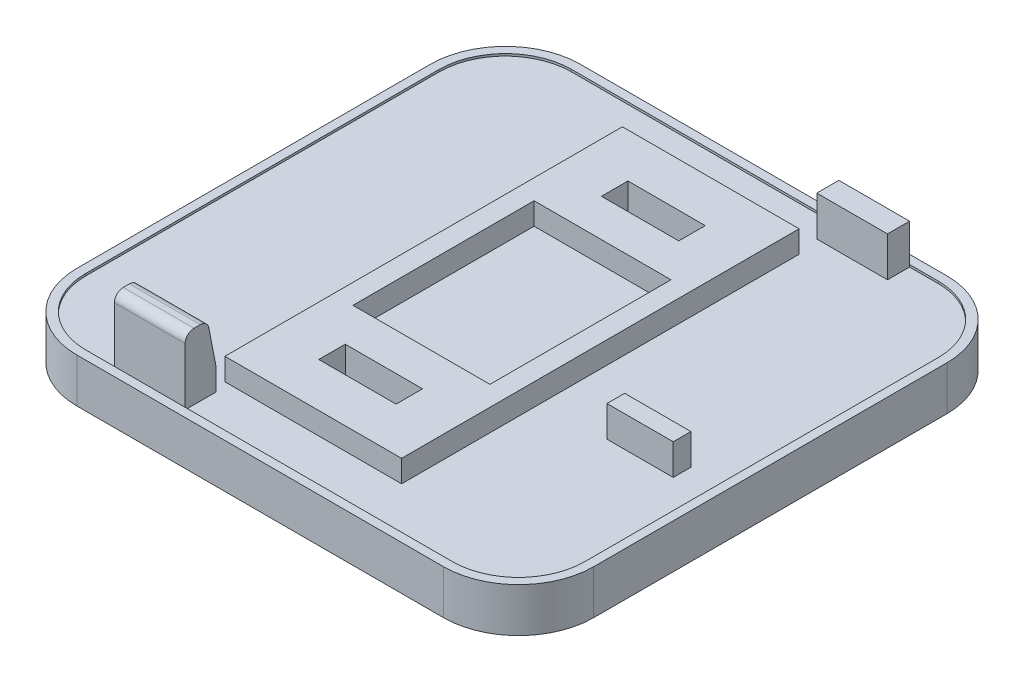
from build123d import *

# Parameters (mm, degrees)
RESSALTO_EXTRUS_O1_DEPTH = 2
CORTE_EXTRUS_O1_DEPTH    = 0.1
ESBO_O3_W                = 8
ESBO_O3_H                = 18
ESBO_O3_W_2              = 6.2
ESBO_O3_H_2              = 8.2
RESSALTO_EXTRUS_O2_DEPTH = 1
ESBO_O4_W                = 3.2
ESBO_O4_H                = 1
RESSALTO_EXTRUS_O3_DEPTH = 1.8
ESBO_O5_W                = 3.2
ESBO_O5_H                = 1.4
RESSALTO_EXTRUS_O4_DEPTH = 3
CHANFRO1_SIZE            = 2
CHANFRO1_SIZE2           = 0.388760618
FILETE1_R                = 0.4
ESBO_O6_W                = 3
ESBO_O6_H                = 0.8
RESSALTO_EXTRUS_O5_DEPTH = 1.4
ESBO_O7_W                = 3.5
ESBO_O7_H                = 1.2
CORTE_EXTRUS_O2_DEPTH    = 5


with BuildPart() as part:
    # Esboço1 → Ressalto-extrusão1 (new body)
    with BuildSketch(Plane(origin=(0, 0, 0), x_dir=(1, 0, 0), z_dir=(0, 1, 0))):
        with BuildLine():
            Line((-8.3, -11.4), (8.3, -11.4))
            ThreePointArc((8.3, -11.4), (10.704163056, -10.404163056), (11.7, -8))
            Line((11.7, -8), (11.7, 8))
            ThreePointArc((11.7, 8), (10.704163056, 10.404163056), (8.3, 11.4))
            Line((8.3, 11.4), (-8.3, 11.4))
            ThreePointArc((-8.3, 11.4), (-10.704163056, 10.404163056), (-11.7, 8))
            Line((-11.7, 8), (-11.7, -8))
            ThreePointArc((-11.7, -8), (-10.704163056, -10.404163056), (-8.3, -11.4))
        make_face()
    extrude(amount=RESSALTO_EXTRUS_O1_DEPTH)

    # Esboço2 → Corte-extrusão1 (cut)
    with BuildSketch(Plane(origin=(0, 2, 0), x_dir=(1, 0, 0), z_dir=(0, 1, 0))):
        with BuildLine():
            Line((-8.3, -11), (8.3, -11))
            ThreePointArc((8.3, -11), (10.421320344, -10.121320344), (11.3, -8))
            Line((11.3, -8), (11.3, 8))
            ThreePointArc((11.3, 8), (10.421320344, 10.121320344), (8.3, 11))
            Line((8.3, 11), (-8.3, 11))
            ThreePointArc((-8.3, 11), (-10.421320344, 10.121320344), (-11.3, 8))
            Line((-11.3, 8), (-11.3, -8))
            ThreePointArc((-11.3, -8), (-10.421320344, -10.121320344), (-8.3, -11))
        make_face()
    extrude(amount=-CORTE_EXTRUS_O1_DEPTH, mode=Mode.SUBTRACT)

    # Esboço3 → Ressalto-extrusão2 (add)
    with BuildSketch(Plane(origin=(0, 1.9, 0), x_dir=(1, 0, 0), z_dir=(0, 1, 0))):
        Rectangle(ESBO_O3_W, ESBO_O3_H)
        Rectangle(ESBO_O3_W_2, ESBO_O3_H_2, mode=Mode.SUBTRACT)
    extrude(amount=RESSALTO_EXTRUS_O2_DEPTH)

    # Esboço4 → Ressalto-extrusão3 (add)
    with BuildSketch(Plane(origin=(0, 1.9, 0), x_dir=(1, 0, 0), z_dir=(0, 1, 0))):
        with Locations((5.4, 10.5)):
            Rectangle(ESBO_O4_W, ESBO_O4_H)
    extrude(amount=RESSALTO_EXTRUS_O3_DEPTH)

    # Esboço5 → Ressalto-extrusão4 (add)
    with BuildSketch(Plane(origin=(0, 1.9, 0), x_dir=(1, 0, 0), z_dir=(0, 1, 0))):
        with Locations((-5.4, -10.3)):
            Rectangle(ESBO_O5_W, ESBO_O5_H)
    extrude(amount=RESSALTO_EXTRUS_O4_DEPTH)

    # Chanfro1
    chanfro1_edges = [part.edges().sort_by_distance(p)[0] for p in [
        (-5.4, 4.9, 9.6),
    ]]
    chanfro1_side = [part.faces().sort_by_distance(p)[0] for p in [
        (-5.4, 3.4, 9.6),
    ]]
    chamfer(chanfro1_edges, length=CHANFRO1_SIZE, length2=CHANFRO1_SIZE2, reference=chanfro1_side[0])

    # Filete1
    filete1_edges = [part.edges().sort_by_distance(p)[0] for p in [
        (-5.4, 4.9, 9.988760618),
        (-5.4, 4.9, 11),
    ]]
    fillet(filete1_edges, radius=FILETE1_R)

    # Esboço6 → Ressalto-extrusão5 (add)
    with BuildSketch(Plane(origin=(0, 1.9, 0), x_dir=(1, 0, 0), z_dir=(0, 1, 0))):
        with Locations((8.4, -2.2)):
            Rectangle(ESBO_O6_W, ESBO_O6_H)
    extrude(amount=RESSALTO_EXTRUS_O5_DEPTH)

    # Esboço7 → Corte-extrusão2 (cut)
    with BuildSketch(Plane(origin=(0, 2.9, 0), x_dir=(1, 0, 0), z_dir=(0, 1, 0))):
        with Locations((0, 6.4)):
            Rectangle(ESBO_O7_W, ESBO_O7_H)
        with Locations((0, -6.4)):
            Rectangle(ESBO_O7_W, ESBO_O7_H)
    extrude(amount=-CORTE_EXTRUS_O2_DEPTH, mode=Mode.SUBTRACT)


solid = part.part
